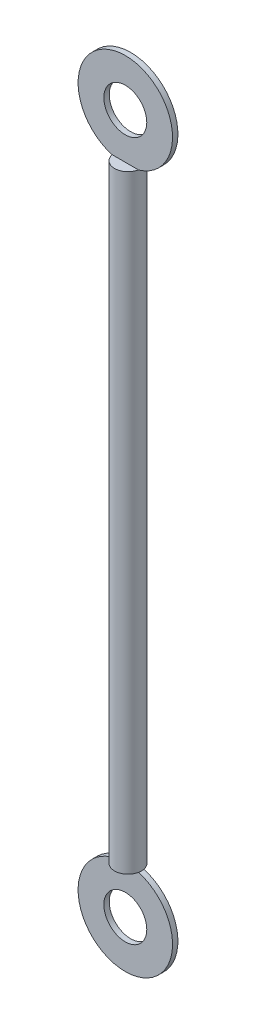
from build123d import *

# Parameters (mm, degrees)
SKETCH1_W           = 7.9375
SKETCH1_H           = 360.02418597
SKETCH1_3_R         = 12.7
BOSS_EXTRUDE1_DEPTH = 1.5875
SCALE1_SCALE        = 0.5


with BuildPart() as part:
    # Sketch1 → Revolve1 (revolve)
    with BuildSketch(Plane.XY):
        with Locations((3.96875, 206.8008909)):
            Rectangle(SKETCH1_W, SKETCH1_H)
    revolve(axis=Axis((0, 386.812983885, 0), (0, -1, 0)))

    # Sketch1<3> → Boss-Extrude1 (add, symmetric)
    # profile 1 of 2: a face of its own
    with BuildSketch(Plane.XY):
        with BuildLine():
            Line((-7.9375, 386.812983885), (7.9375, 386.812983885))
            ThreePointArc((7.9375, 386.812983885), (0, 441.541781801), (-7.9375, 386.812983885))
        make_face()
        with Locations((0, 413.601781801)):
            Circle(SKETCH1_3_R, mode=Mode.SUBTRACT)
    # profile 2 of 2: a face of its own
    with BuildSketch(Plane.XY):
        with BuildLine():
            Line((7.9375, 26.788797915), (-7.9375, 26.788797915))
            ThreePointArc((-7.9375, 26.788797915), (0, -27.94), (7.9375, 26.788797915))
        make_face()
        Circle(SKETCH1_3_R, mode=Mode.SUBTRACT)
    extrude(amount=BOSS_EXTRUDE1_DEPTH, both=True)


with BuildPart() as part_1:
    # Scale1: scaled about (0, 206.8008909, 0)
    add(part.part.scale(SCALE1_SCALE).moved(Location((0, 103.40044545, 0))))


solid = part_1.part
